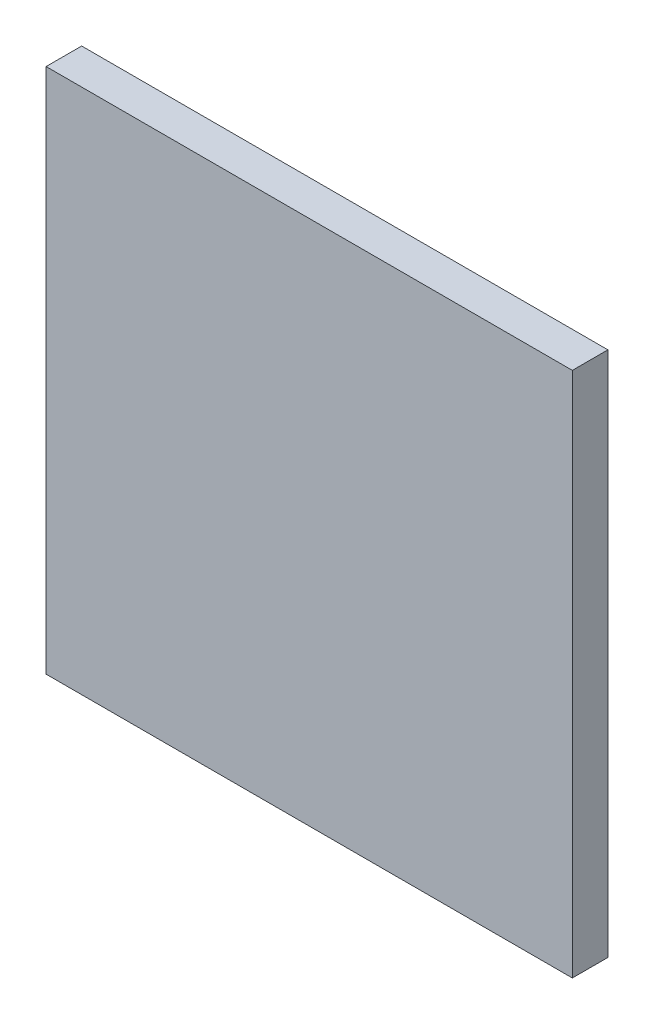
from build123d import *

# Parameters (mm, degrees)
CROQUIS1_W              = 370
CROQUIS1_H              = 370
SALIENTE_EXTRUIR1_DEPTH = 25


with BuildPart() as part:
    # Croquis1 → Saliente-Extruir1 (new body)
    with BuildSketch(Plane.XY):
        with Locations((790.123437975, 509.281976167)):
            Rectangle(CROQUIS1_W, CROQUIS1_H)
    extrude(amount=SALIENTE_EXTRUIR1_DEPTH)


solid = part.part
